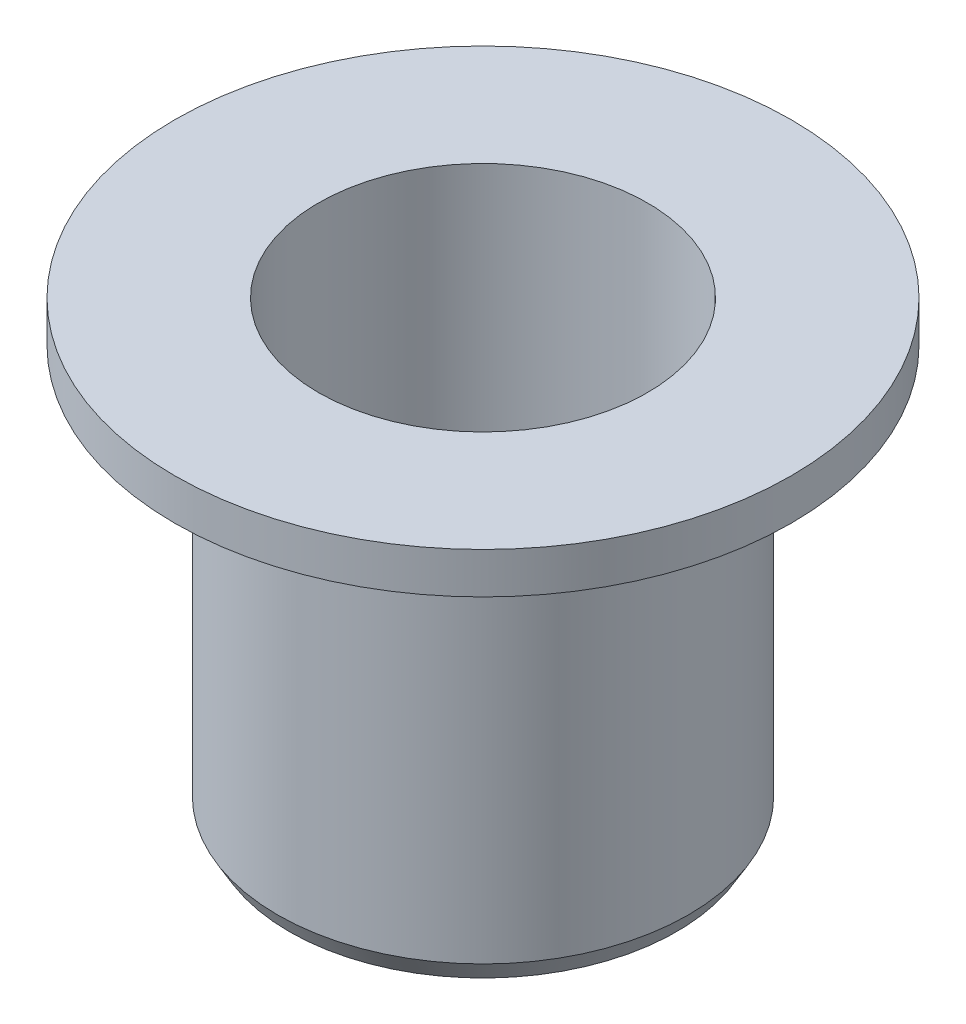
from build123d import *


with BuildPart() as part:
    # Sketch1 → Revolve1 (revolve)
    with BuildSketch(Plane.XY, mode=Mode.PRIVATE) as revolve1_sk:
        with BuildLine():
            Line((-7.5, 0), (-7.5, -1))
            Line((-7.5, -1), (-5.5, -1))
            ThreePointArc((-5.5, -1), (-5.146446609, -1.146446609), (-5, -1.5))
            Line((-5, -1.5), (-5, -10.5))
            Line((-5, -10.5), (-4.711324865, -11))
            Line((-4.711324865, -11), (-4, -11))
            Line((-4, -11), (-4, 0))
            Line((-4, 0), (-7.5, 0))
        make_face()
    revolve(revolve1_sk.sketch.rotate(Axis((0, 0, 0), (0, -1, 0)), 270), axis=Axis((0, 0, 0), (0, -1, 0)))


solid = part.part
